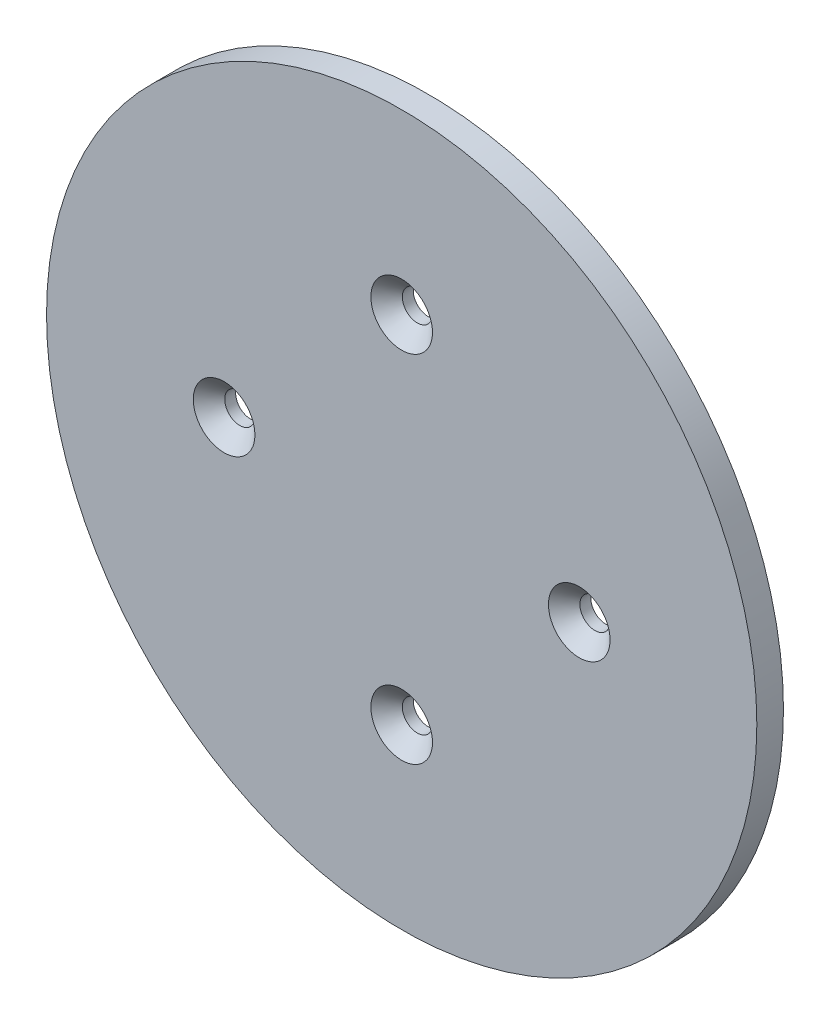
from build123d import *

# Parameters (mm, degrees)
SKETCH_1_R                   = 40
EXTRUDE_1_DEPTH              = 3
HOLE_WIZARD_M3_1_D           = 3.4
HOLE_WIZARD_M3_1_DEPTH       = 10.12
HOLE_WIZARD_M3_1_CSINK_D     = 6.94
HOLE_WIZARD_M3_1_CSINK_ANGLE = 90
HOLE_WIZARD_M3_1_TIP         = 1.021463052


with BuildPart() as part:
    # 草图1 → 凸台-拉伸1 (new body)
    with BuildSketch(Plane.XY):
        Circle(SKETCH_1_R)
    extrude(amount=EXTRUDE_1_DEPTH)

    # M3 六角凹锥坑头螺钉的锥形沉头孔1
    with Locations(Plane(origin=(0, 20, 3), x_dir=(1, 0, 0), z_dir=(0, 0, 1))):
        with Locations((0, 0), (20, -20), (0, -40), (-20, -20)):
            CounterSinkHole(HOLE_WIZARD_M3_1_D / 2, HOLE_WIZARD_M3_1_CSINK_D / 2, depth=HOLE_WIZARD_M3_1_DEPTH, counter_sink_angle=HOLE_WIZARD_M3_1_CSINK_ANGLE)
            with Locations((0, 0, -(HOLE_WIZARD_M3_1_DEPTH + HOLE_WIZARD_M3_1_TIP / 2))):  # 118° drill point
                Cone(0, HOLE_WIZARD_M3_1_D / 2, HOLE_WIZARD_M3_1_TIP, mode=Mode.SUBTRACT)


solid = part.part
